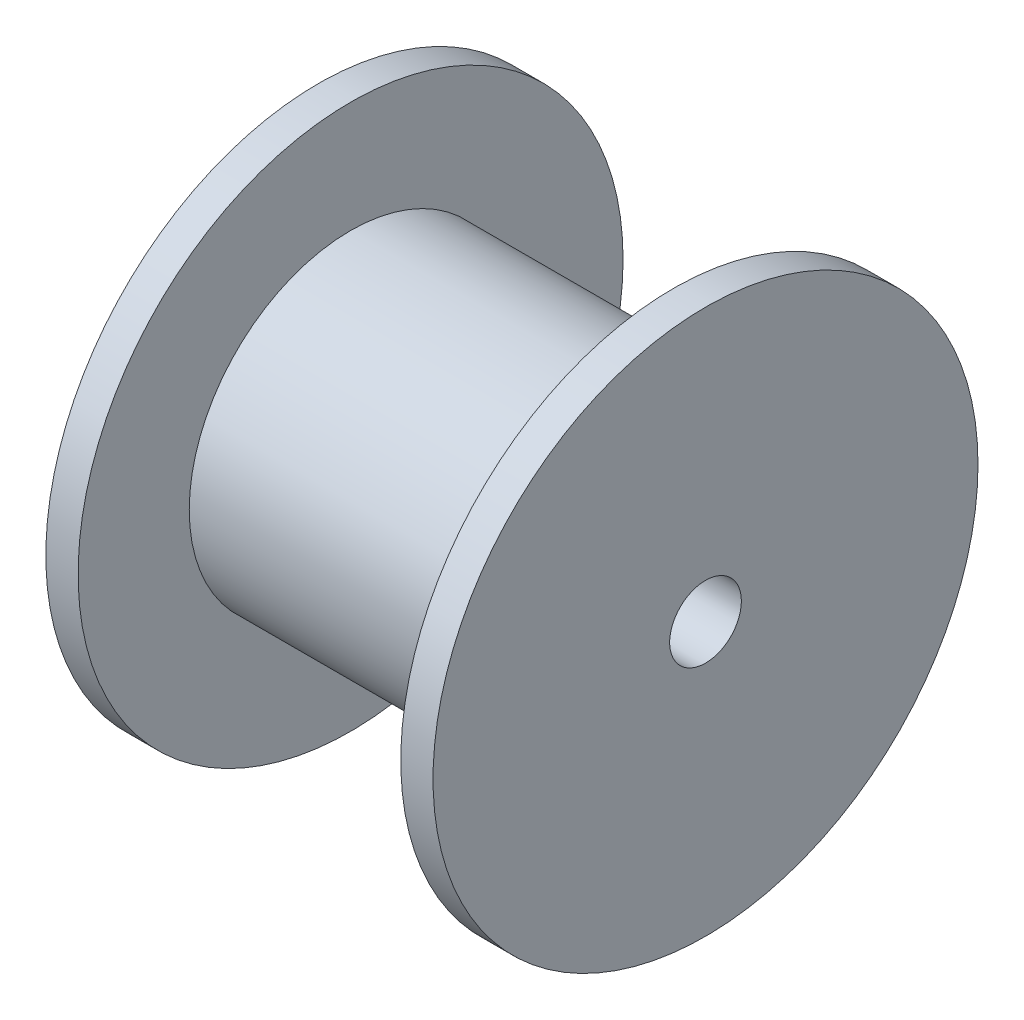
from build123d import *

# Parameters (mm, degrees)
CROQUIS1_R              = 76
SALIENTE_EXTRUIR1_DEPTH = 9
CROQUIS2_R              = 45
SALIENTE_EXTRUIR2_DEPTH = 90
CROQUIS3_R              = 76
SALIENTE_EXTRUIR3_DEPTH = 9
CROQUIS4_R              = 10
CORTAR_EXTRUIR1_DEPTH   = 108


with BuildPart() as part:
    # Croquis1 → Saliente-Extruir1 (new body)
    with BuildSketch(Plane(origin=(0, 0, 0), x_dir=(0, 0, -1), z_dir=(1, 0, 0))):
        Circle(CROQUIS1_R)
    extrude(amount=SALIENTE_EXTRUIR1_DEPTH)

    # Croquis2 → Saliente-Extruir2 (add)
    with BuildSketch(Plane(origin=(9, 0, 0), x_dir=(0, 0, -1), z_dir=(1, 0, 0))):
        with Locations(Location((0, 0, 0), (0, 0, 180))):
            Circle(CROQUIS2_R)
    extrude(amount=SALIENTE_EXTRUIR2_DEPTH)

    # Croquis3 → Saliente-Extruir3 (add)
    with BuildSketch(Plane(origin=(99, 0, 0), x_dir=(0, 0, -1), z_dir=(1, 0, 0))):
        Circle(CROQUIS3_R)
    extrude(amount=SALIENTE_EXTRUIR3_DEPTH)

    # Croquis4 → Cortar-Extruir1 (cut)
    with BuildSketch(Plane(origin=(108, 0, 0), x_dir=(0, 0, -1), z_dir=(1, 0, 0))):
        Circle(CROQUIS4_R)
    extrude(amount=-CORTAR_EXTRUIR1_DEPTH, mode=Mode.SUBTRACT)


solid = part.part
